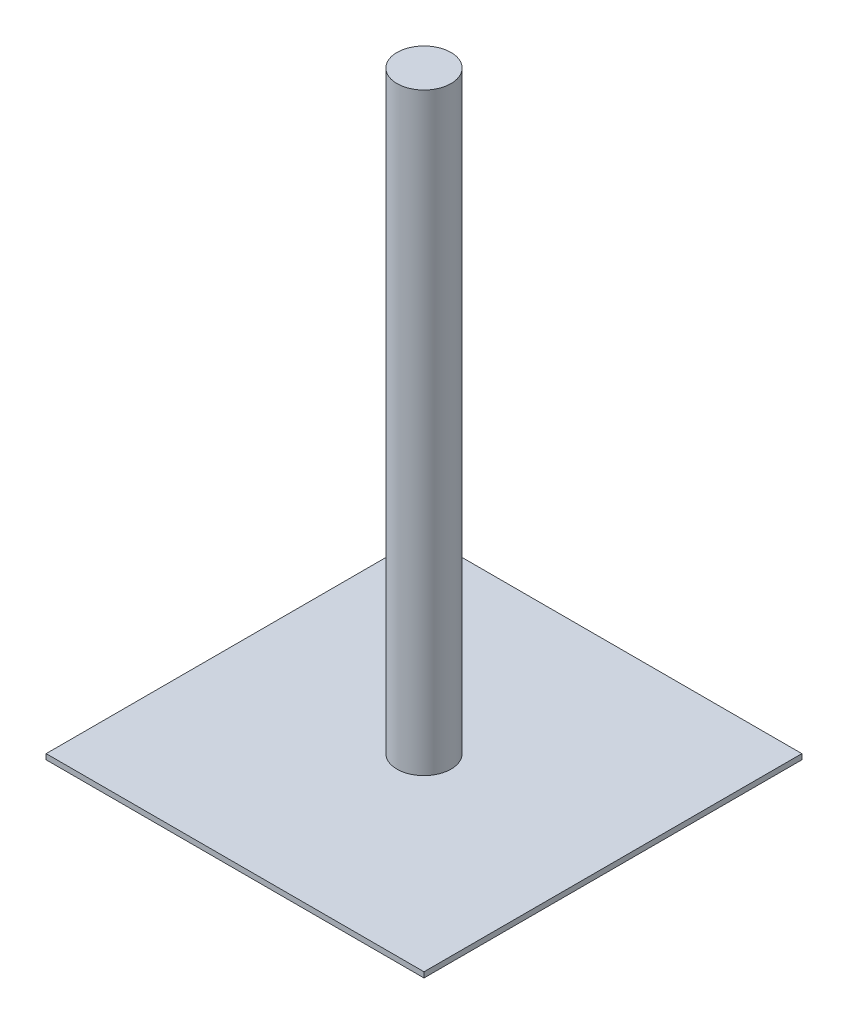
from build123d import *

# Parameters (mm, degrees)
SKETCH1_W           = 700
SKETCH1_H           = 700
BOSS_EXTRUDE1_DEPTH = 10
SKETCH3_R           = 50
BOSS_EXTRUDE2_DEPTH = 1100


with BuildPart() as part:
    # Sketch1 → Boss-Extrude1 (new body)
    with BuildSketch(Plane(origin=(0, 0, 0), x_dir=(1, 0, 0), z_dir=(0, 1, 0))):
        Rectangle(SKETCH1_W, SKETCH1_H)
    extrude(amount=BOSS_EXTRUDE1_DEPTH)

    # Sketch3 → Boss-Extrude2 (add)
    with BuildSketch(Plane(origin=(0, 10, 0), x_dir=(1, 0, 0), z_dir=(0, 1, 0))):
        with Locations(Location((0, 0, 0), (0, 0, 90))):
            Circle(SKETCH3_R)
    extrude(amount=BOSS_EXTRUDE2_DEPTH)


solid = part.part
